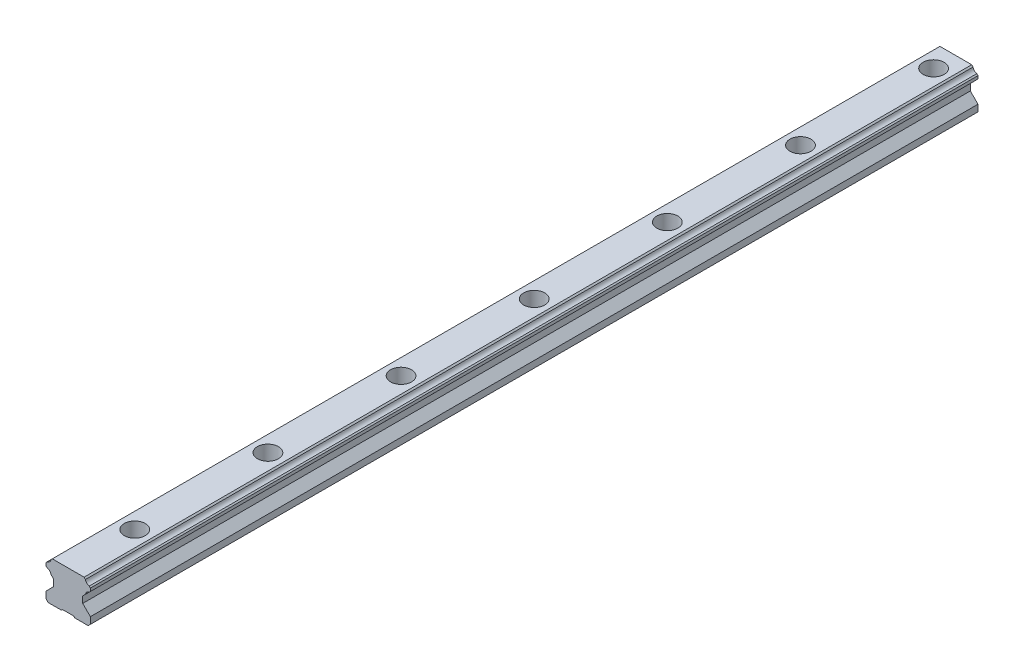
from build123d import *

# Parameters (mm, degrees)
BOSS_EXTRUDE1_DEPTH = 200
LPATTERN1_COUNT     = 7
LPATTERN1_PITCH     = 60


with BuildPart() as part:
    # Sketch1 → Boss-Extrude1 (new, symmetric)
    with BuildSketch(Plane.XY):
        with BuildLine():
            Line((-10, -10.494534492), (-10, -13.49461174))
            Line((-10, -13.49461174), (-9, -14.49461174))
            Line((-9, -14.49461174), (-3, -14.49461174))
            Line((-3, -14.49461174), (-2.5, -13.99461174))
            Line((-2.5, -13.99461174), (2.5, -13.99461174))
            Line((2.5, -13.99461174), (3, -14.49461174))
            Line((3, -14.49461174), (9, -14.49461174))
            Line((9, -14.49461174), (10, -13.49461174))
            Line((10, -13.49461174), (10, -10.494534492))
            Line((10, -10.494534492), (6.550048828, -7.044660568))
            Line((6.550048828, -7.044660568), (6.550048828, -4.115376472))
            Line((6.550048828, -4.115376472), (7.767930373, -2.899480236))
            ThreePointArc((7.767930373, -2.899480236), (8.341068744, -1.762979997), (9.472673258, -1.180235103))
            Line((9.472673258, -1.180235103), (10, -0.665425301))
            Line((10, -0.665425301), (10, 0.665425301))
            Line((10, 0.665425301), (9.472673258, 1.192752043))
            ThreePointArc((9.472673258, 1.192752043), (8.344874488, 1.769695527), (7.767930373, 2.897493974))
            Line((7.767930373, 2.897493974), (7.160036564, 3.50538826))
            Line((7.160036564, 3.50538826), (-7.160036564, 3.50538826))
            Line((-7.160036564, 3.50538826), (-7.767930373, 2.897493974))
            ThreePointArc((-7.767930373, 2.897493974), (-8.344874488, 1.769695527), (-9.472673258, 1.192752043))
            Line((-9.472673258, 1.192752043), (-10, 0.665425301))
            Line((-10, 0.665425301), (-10, -0.665425301))
            Line((-10, -0.665425301), (-9.472673258, -1.180235103))
            ThreePointArc((-9.472673258, -1.180235103), (-8.341068744, -1.762979997), (-7.767930373, -2.899480236))
            Line((-7.767930373, -2.899480236), (-6.550048828, -4.115376472))
            Line((-6.550048828, -4.115376472), (-6.550048828, -7.044660568))
            Line((-6.550048828, -7.044660568), (-10, -10.494534492))
        make_face()
    extrude(amount=BOSS_EXTRUDE1_DEPTH, both=True)

    # Sketch2 → Cut-Revolve1 (revolve, cut)
    with BuildSketch(Plane(origin=(0, 0, 0), x_dir=(0, 0, -1), z_dir=(1, 0, 0))):
        Polygon((-170, 3.50538826), (-170, -14.49461174), (-173, -14.49461174), (-173, -4.99461174), (-174.75, -4.99461174), (-174.75, 3.50538826), align=None)
    cut_revolve1 = revolve(axis=Axis((0, 3.50538826, 170), (0, -1, 0)), mode=Mode.SUBTRACT)

    # LPattern1: Cut-Revolve1 ×7
    with Locations(*[(0, 0, -i * LPATTERN1_PITCH) for i in range(1, LPATTERN1_COUNT)]):
        add(cut_revolve1, mode=Mode.SUBTRACT)


solid = part.part
